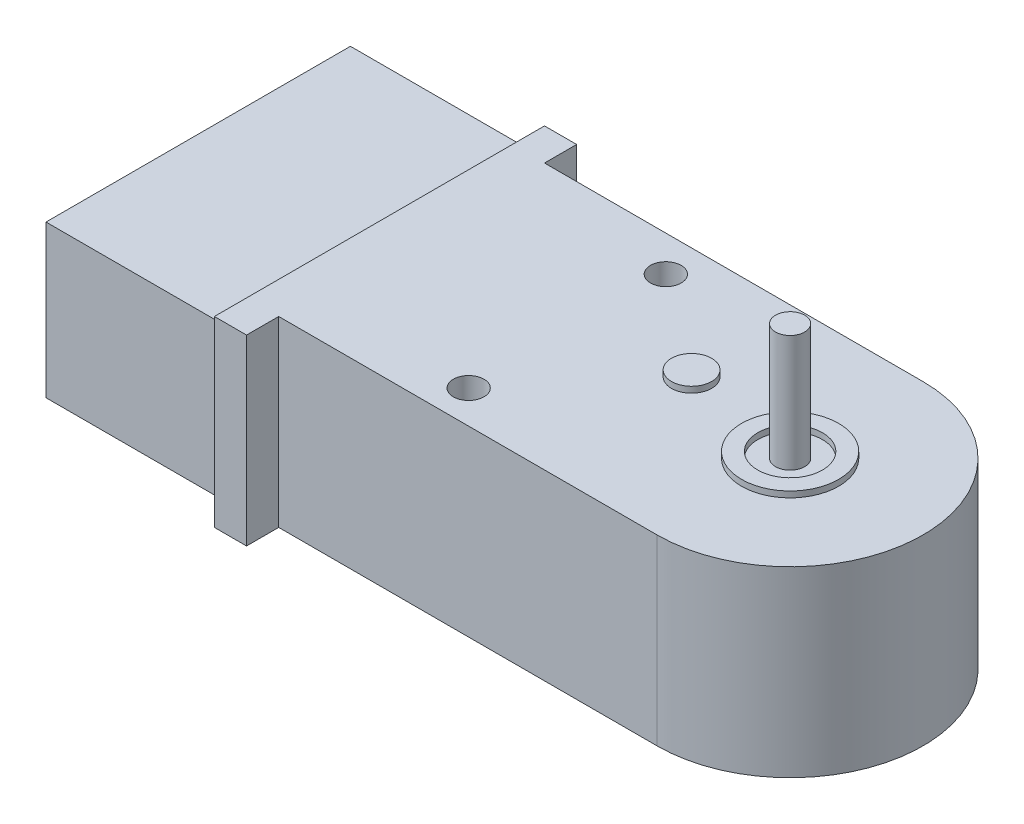
from build123d import *

# Parameters (mm, degrees)
GEAR_BOX_DEPTH      = 6.86
GEAR_BOX_DEPTH_BACK = 6.86
MOTOR_DEPTH         = 5.715
MOTOR_DEPTH_BACK    = 5.715
SKETCH2_W           = 13.61
SKETCH2_H           = 22.86
SKETCH3_R           = 1.51
SKETCH3_R_2         = 3.645
SKETCH3_R_3         = 2.43
SPACER_DEPTH        = 0.45
SPACER_BACK_START   = 0.45
SKETCH5_R           = 3.645
SKETCH5_R_2         = 2.43
SPACER_BACK_DEPTH   = 0.45
SKETCH4_R           = 1.095
OUTPUT_SHAFT_DEPTH  = 8.76
SKETCH7_R           = 1.15
CUT_EXTRUDE1_DEPTH  = 5


with BuildPart() as part:
    # Sketch1 → Gear Box (new, two sides: drawn at the far end of the back side and taken through both)
    with BuildSketch(Plane(origin=(0, 0, 0), x_dir=(1, 0, 0), z_dir=(0, 1, 0)).offset(-GEAR_BOX_DEPTH_BACK)):
        with BuildLine():
            Line((0, 9.98), (-28.425, 9.98))
            Line((-28.425, 9.98), (-28.425, 12.395))
            Line((-28.425, 12.395), (-30.84, 12.395))
            Line((-30.84, 12.395), (-30.84, -12.395))
            Line((-30.84, -12.395), (-28.425, -12.395))
            Line((-28.425, -12.395), (-28.425, -9.98))
            Line((-28.425, -9.98), (0, -9.98))
            ThreePointArc((0, -9.98), (9.98, 0), (0, 9.98))
        make_face()
    extrude(amount=GEAR_BOX_DEPTH + GEAR_BOX_DEPTH_BACK)

    # Sketch2 → Motor (add, two sides: drawn at the far end of the back side and taken through both)
    with BuildSketch(Plane(origin=(0, 0, 0), x_dir=(1, 0, 0), z_dir=(0, 1, 0)).offset(-MOTOR_DEPTH_BACK)):
        with Locations((-37.645, 0)):
            Rectangle(SKETCH2_W, SKETCH2_H)
    extrude(amount=MOTOR_DEPTH + MOTOR_DEPTH_BACK)

    # Sketch3 → Spacer (add)
    # profile 1 of 2: a face of its own
    with BuildSketch(Plane(origin=(0, 6.86, 0), x_dir=(1, 0, 0), z_dir=(0, 1, 0))):
        with Locations(Location((-9, 1.6, 0), (0, 0, 270))):
            Circle(SKETCH3_R)
    # profile 2 of 2: a face of its own
    with BuildSketch(Plane(origin=(0, 6.86, 0), x_dir=(1, 0, 0), z_dir=(0, 1, 0))):
        with Locations(Location((0, 0, 0), (0, 0, 270))):
            Circle(SKETCH3_R_2)
        with Locations(Location((0, 0, 0), (0, 0, 270))):
            Circle(SKETCH3_R_3, mode=Mode.SUBTRACT)
    extrude(amount=SPACER_DEPTH)

    # Sketch5 → Spacer(back) (add)
    with BuildSketch(Plane.XZ.offset(6.86).offset(SPACER_BACK_START)):
        with Locations(Location((0, 0, 0), (0, 0, 90))):
            Circle(SKETCH5_R)
        with Locations(Location((0, 0, 0), (0, 0, 90))):
            Circle(SKETCH5_R_2, mode=Mode.SUBTRACT)
    extrude(amount=-SPACER_BACK_DEPTH)

    # Sketch4 → Output Shaft (add)
    with BuildSketch(Plane(origin=(0, 6.86, 0), x_dir=(1, 0, 0), z_dir=(0, 1, 0))):
        with Locations(Location((0, 0, 0), (0, 0, 270))):
            Circle(SKETCH4_R)
    extrude(amount=OUTPUT_SHAFT_DEPTH)

    # Sketch7 → Cut-Extrude1 (cut)
    with BuildSketch(Plane(origin=(0, 6.86, 0), x_dir=(1, 0, 0), z_dir=(0, 1, 0))):
        with Locations(Location((-16.64, 7.30523239, 0), (0, 0, 270))):
            Circle(SKETCH7_R)
        with Locations(Location((-16.64, -7.5, 0), (0, 0, 270))):
            Circle(SKETCH7_R)
    extrude(amount=-CUT_EXTRUDE1_DEPTH, mode=Mode.SUBTRACT)


solid = part.part
